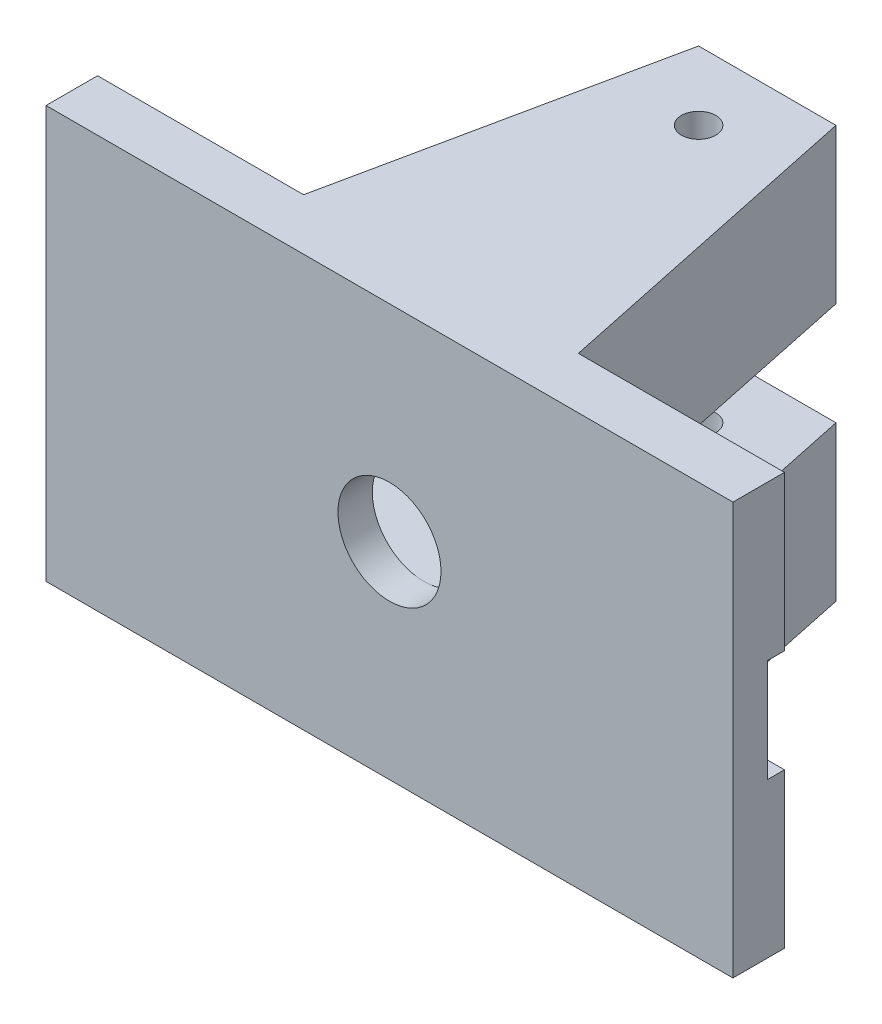
from build123d import *

# Parameters (mm, degrees)
SKETCH_1_W          = 200
SKETCH_1_H          = 120
SKETCH_1_R          = 15
EXTRUDE_1_DEPTH     = 10
SKETCH_2_W          = 200
SKETCH_2_H          = 45
EXTRUDE_2_DEPTH     = 100
SKETCH_3_R          = 5
CUT_EXTRUDE_1_DEPTH = 186.47236991


with BuildPart() as part:
    # 草图1 → 凸台-拉伸1 (new body)
    with BuildSketch(Plane.XY):
        Rectangle(SKETCH_1_W, SKETCH_1_H)
        Circle(SKETCH_1_R, mode=Mode.SUBTRACT)
    extrude(amount=EXTRUDE_1_DEPTH)

    # 草图2 → 凸台-拉伸2 (add)
    with BuildSketch(Plane(origin=(0, 0, 0), x_dir=(-1, 0, 0), z_dir=(0, 0, -1))):
        with Locations((0, 37.5)):
            Rectangle(SKETCH_2_W, SKETCH_2_H)
        with Locations((0, -37.5)):
            Rectangle(SKETCH_2_W, SKETCH_2_H)
    extrude(amount=EXTRUDE_2_DEPTH)

    # 草图3 → 切除-拉伸1 (cut, through all)
    with BuildSketch(Plane(origin=(0, 60, 0), x_dir=(1, 0, 0), z_dir=(0, 1, 0))):
        with Locations(Location((0, 80, 0), (0, 0, 180))):
            Circle(SKETCH_3_R)
        Polygon((-100, 5), (-100, 100), (-20, 100), (-40, 5), align=None)
        Polygon((100, 100), (20, 100), (40, 5), (100, 5), align=None)
    extrude(amount=-CUT_EXTRUDE_1_DEPTH, mode=Mode.SUBTRACT)


solid = part.part
